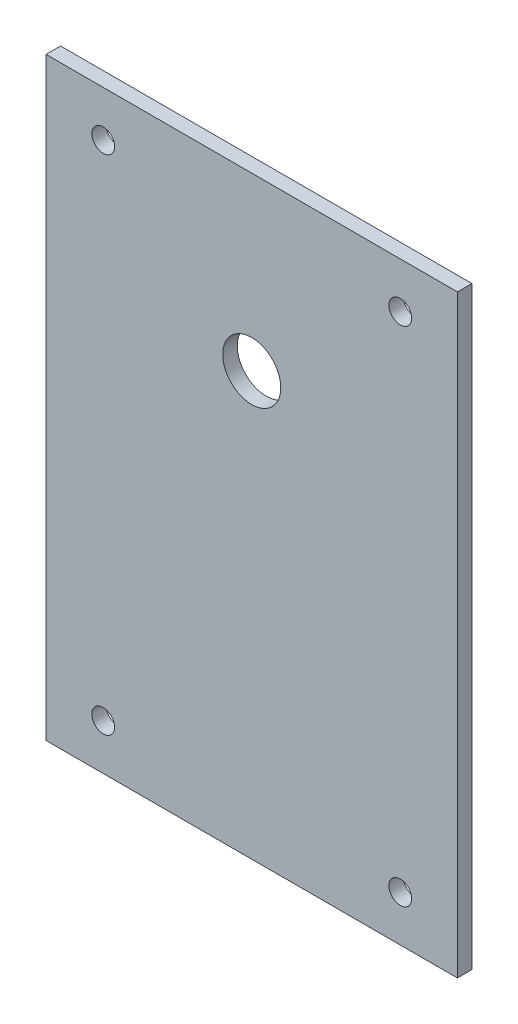
from build123d import *

# Parameters (mm, degrees)
SKETCH1_W           = 90
SKETCH1_H           = 130
BOSS_EXTRUDE1_DEPTH = 3.175
SKETCH2_R           = 2.5
CUT_EXTRUDE1_DEPTH  = 3.175
SKETCH3_R           = 6.35
CUT_EXTRUDE2_DEPTH  = 3.175


with BuildPart() as part:
    # Sketch1 → Boss-Extrude1 (new body)
    with BuildSketch(Plane.XY):
        with Locations((-45, 65)):
            Rectangle(SKETCH1_W, SKETCH1_H)
    extrude(amount=BOSS_EXTRUDE1_DEPTH)

    # Sketch2 → Cut-Extrude1 (cut)
    with BuildSketch(Plane.XY.offset(3.175)):
        with Locations((-77.5, 120)):
            Circle(SKETCH2_R)
        with Locations((-12.5, 120)):
            Circle(SKETCH2_R)
    cut_extrude1 = extrude(amount=-CUT_EXTRUDE1_DEPTH, mode=Mode.SUBTRACT)

    # Mirror1: Cut-Extrude1 across plane
    add(cut_extrude1.mirror(Plane.ZX.offset(65)), mode=Mode.SUBTRACT)

    # Sketch3 → Cut-Extrude2 (cut)
    with BuildSketch(Plane.XY.offset(3.175)):
        with Locations((-45, 92.5)):
            Circle(SKETCH3_R)
    extrude(amount=-CUT_EXTRUDE2_DEPTH, mode=Mode.SUBTRACT)


solid = part.part
